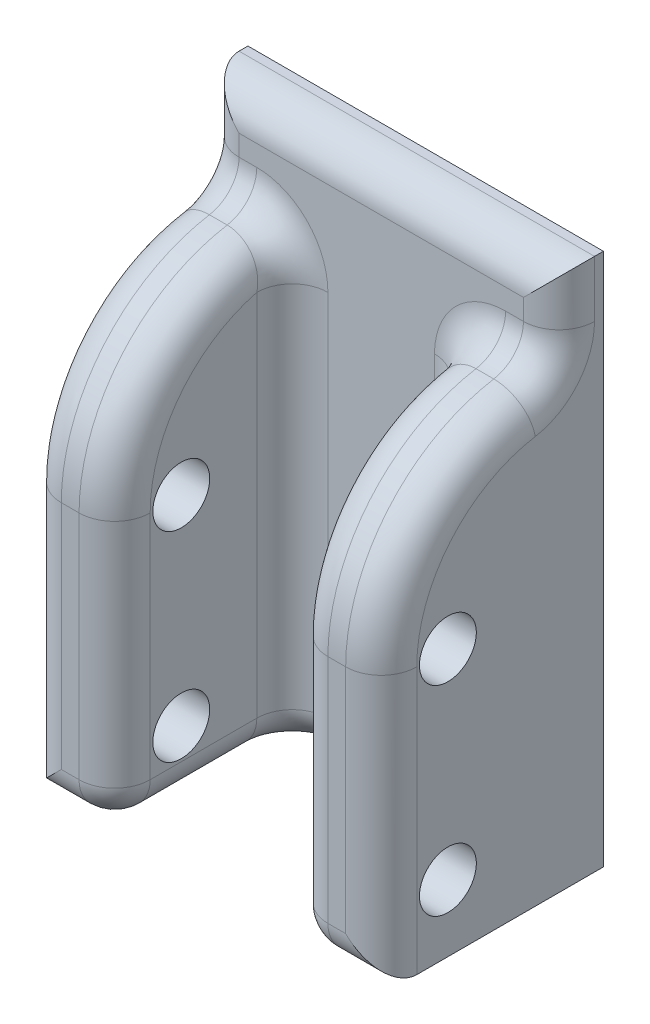
from build123d import *

# Parameters (mm, degrees)
SKETCH1_W           = 25.4
SKETCH1_H           = 38.1
SKETCH1_R           = 2.032
BOSS_EXTRUDE1_DEPTH = 3.175
SKETCH2_R           = 2.032
BOSS_EXTRUDE2_DEPTH = 25.4
SKETCH3_W           = 12.7
SKETCH3_H           = 31.75
SKETCH3_W_2         = 3.175
CUT_EXTRUDE1_DEPTH  = 27.181720723
FILLET1_R           = 2.54


with BuildPart() as part:
    # Sketch1 → Boss-Extrude1 (new body)
    with BuildSketch(Plane.XY):
        Rectangle(SKETCH1_W, SKETCH1_H)
        with Locations((-8.466666667, 9.525)):
            Circle(SKETCH1_R, mode=Mode.SUBTRACT)
        with Locations((8.466666667, 9.525)):
            Circle(SKETCH1_R, mode=Mode.SUBTRACT)
        with Locations((-8.466666667, -9.525)):
            Circle(SKETCH1_R, mode=Mode.SUBTRACT)
        with Locations((8.466666667, -9.525)):
            Circle(SKETCH1_R, mode=Mode.SUBTRACT)
    extrude(amount=BOSS_EXTRUDE1_DEPTH)

    # Sketch2 → Boss-Extrude2 (add)
    with BuildSketch(Plane.ZY.offset(12.7)):
        with BuildLine():
            ThreePointArc((15.875, 0), (12.155256121, 8.980256121), (3.175, 12.7))
            Line((3.175, 12.7), (3.175, -19.05))
            Line((3.175, -19.05), (15.875, -19.05))
            Line((15.875, -19.05), (15.875, 0))
        make_face()
        with Locations((11.1125, 0)):
            Circle(SKETCH2_R, mode=Mode.SUBTRACT)
        with Locations((11.1125, -14.2875)):
            Circle(SKETCH2_R, mode=Mode.SUBTRACT)
    extrude(amount=-BOSS_EXTRUDE2_DEPTH)

    # Sketch3 → Cut-Extrude1 (cut, through all)
    with BuildSketch(Plane.XY.offset(3.175)):
        with Locations((0, -3.175)):
            Rectangle(SKETCH3_W, SKETCH3_H)
        with Locations((-14.2875, -3.175)):
            Rectangle(SKETCH3_W_2, SKETCH3_H)
        with Locations((14.2875, -3.175)):
            Rectangle(SKETCH3_W_2, SKETCH3_H)
    extrude(amount=CUT_EXTRUDE1_DEPTH, mode=Mode.SUBTRACT)

    # Fillet1
    fillet1_edges = [part.edges().sort_by_distance(p)[0] for p in [
        (0, 19.05, 3.175),
        (12.7, 15.875, 3.175),
        (9.525, -19.05, 15.875),
        (12.7, -9.525, 15.875),
        (-12.7, -9.525, 15.875),
        (12.7, 8.980256121, 12.155256121),
        (9.525, 12.7, 3.175),
        (-12.7, 8.980256121, 12.155256121),
        (-12.7, 15.875, 3.175),
        (-9.525, 12.7, 3.175),
        (6.35, 8.980256121, 12.155256121),
        (-6.35, 8.980256121, 12.155256121),
        (-9.525, -19.05, 15.875),
        (-6.35, -3.175, 3.175),
        (6.35, -19.05, 9.525),
        (6.35, -3.175, 3.175),
        (6.35, -9.525, 15.875),
        (-6.35, -9.525, 15.875),
        (0, -19.05, 3.175),
        (-6.35, -19.05, 9.525),
    ]]
    fillet(fillet1_edges, radius=FILLET1_R)


solid = part.part
